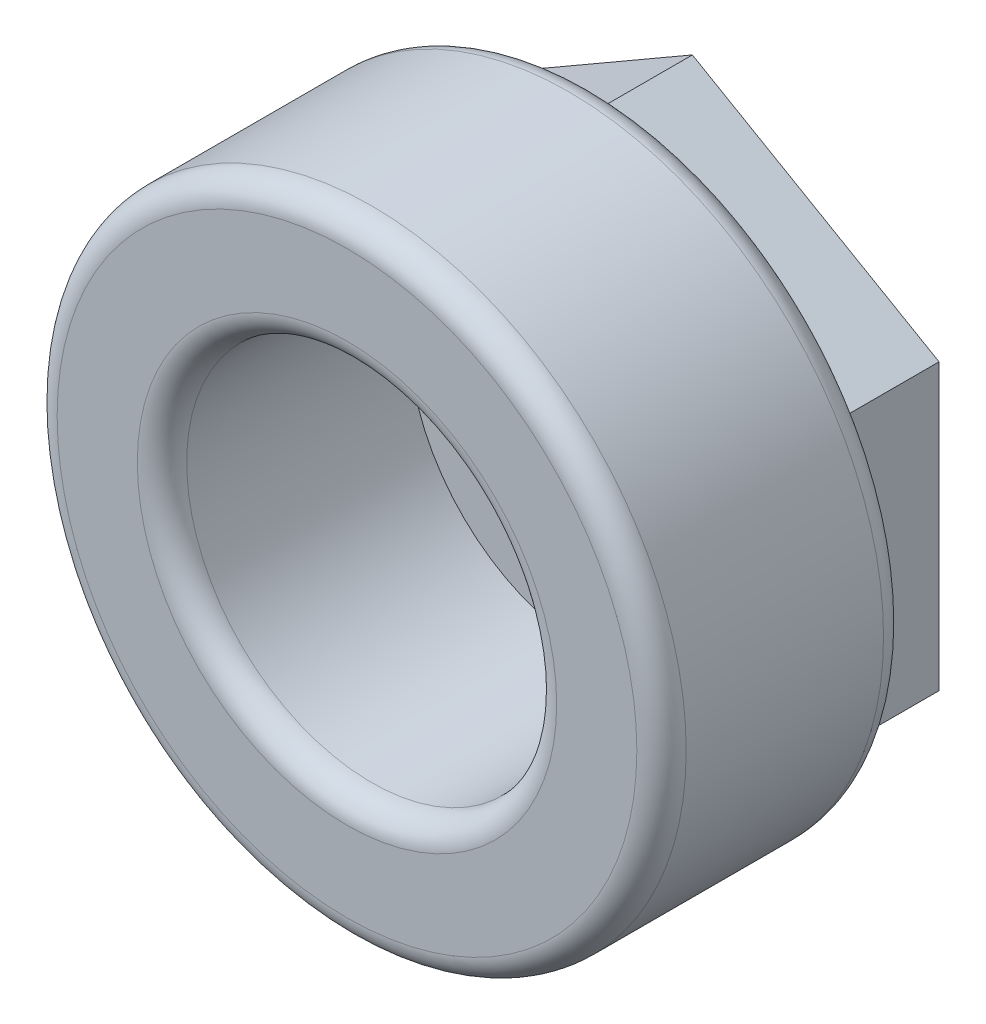
from build123d import *

# Parameters (mm, degrees)
EXTRUDE_1_DEPTH     = 0.8
SKETCH_2_R          = 2.55
SKETCH_2_R_2        = 1.5
EXTRUDE_2_DEPTH     = 2
SKETCH_3_R          = 1
CUT_EXTRUDE_1_DEPTH = 5.12371192
FILLET_1_R          = 0.2


with BuildPart() as part:
    # 草图1 → 凸台-拉伸1 (new body)
    with BuildSketch(Plane.XY):
        Polygon((0, -2.309401077), (2, -1.154700538), (2, 1.154700538), (0, 2.309401077), (-2, 1.154700538), (-2, -1.154700538), align=None)
    extrude(amount=EXTRUDE_1_DEPTH)

    # 草图2 → 凸台-拉伸2 (add)
    with BuildSketch(Plane.XY.offset(0.8)):
        Circle(SKETCH_2_R)
        Circle(SKETCH_2_R_2, mode=Mode.SUBTRACT)
    extrude(amount=EXTRUDE_2_DEPTH)

    # 草图3 → 切除-拉伸1 (cut, through all)
    with BuildSketch(Plane.XY.offset(0.8)):
        Circle(SKETCH_3_R)
    extrude(amount=-CUT_EXTRUDE_1_DEPTH, mode=Mode.SUBTRACT)

    # 圆角1
    fillet_1_edges = [part.edges().sort_by_distance(p)[0] for p in [
        (-2.55, 0, 2.8),
        (-2.55, 0, 0.8),
        (-1.5, 0, 2.8),
    ]]
    fillet(fillet_1_edges, radius=FILLET_1_R)


solid = part.part
